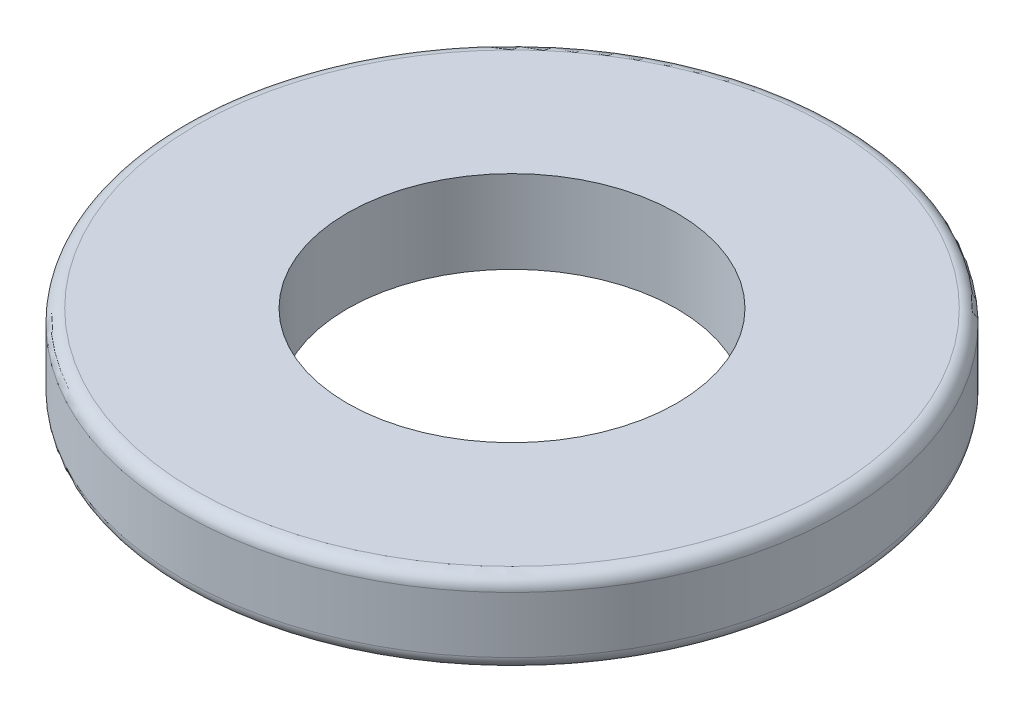
from build123d import *

# Parameters (mm, degrees)
SKETCH1_R           = 6.3119
SKETCH1_R_2         = 3.15595
BOSS_EXTRUDE1_DEPTH = 1.5875
FILLET1_R           = 0.254


with BuildPart() as part:
    # Sketch1 → Boss-Extrude1 (new body)
    with BuildSketch(Plane(origin=(0, 0, 0), x_dir=(1, 0, 0), z_dir=(0, 1, 0))):
        with Locations(Location((0, 0, 0), (0, 0, 270))):
            Circle(SKETCH1_R)
        with Locations(Location((0, 0, 0), (0, 0, 270))):
            Circle(SKETCH1_R_2, mode=Mode.SUBTRACT)
    extrude(amount=BOSS_EXTRUDE1_DEPTH)

    # Fillet1
    fillet1_edges = [part.edges().sort_by_distance(p)[0] for p in [
        (0, 0, -6.3119),
        (0, 1.5875, -6.3119),
    ]]
    fillet(fillet1_edges, radius=FILLET1_R)


solid = part.part
